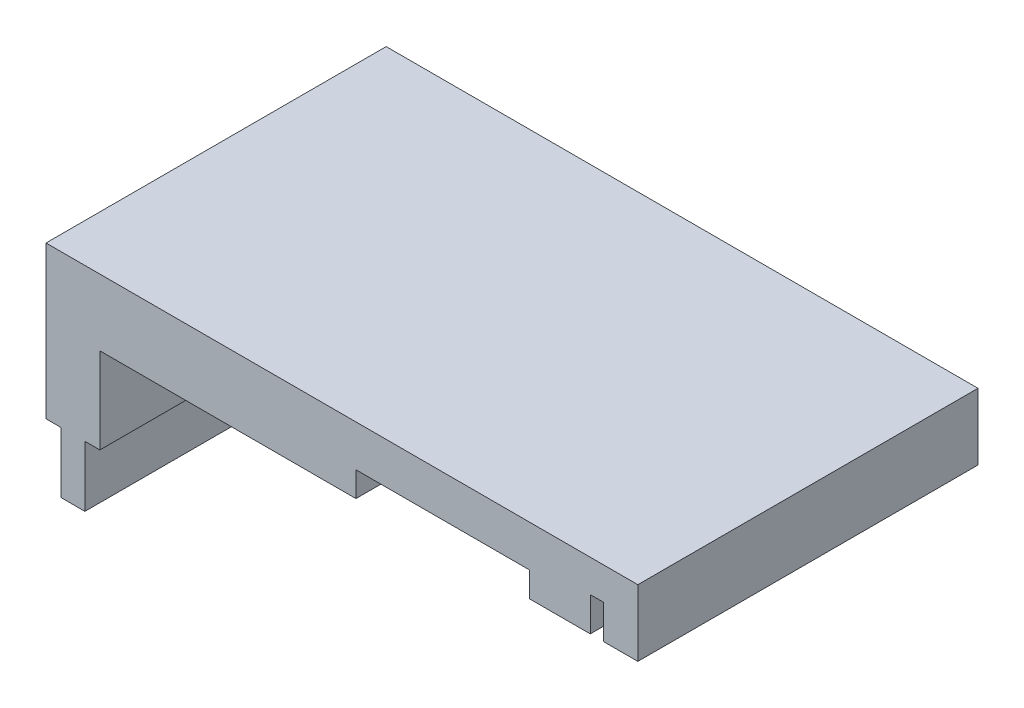
from build123d import *

# Parameters (mm, degrees)
BOSS_EXTRUDE1_DEPTH = 95.25
SKETCH3_W           = 9
SKETCH3_H           = 41.03
CUT_EXTRUDE1_DEPTH  = 183.880891019
SKETCH4_R           = 1.03
CUT_EXTRUDE2_DEPTH  = 3


with BuildPart() as part:
    # Sketch1 → Boss-Extrude1 (new body)
    with BuildSketch(Plane.XY):
        Polygon((0, 0), (0, 18.61), (-165.72, 18.61), (-165.72, -24.03), (-161.52, -24.03), (-161.52, -41.03), (-154.83, -41.03), (-154.83, -24.03), (-150.63, -24.03), (-150.63, 0.01), (-78.94, 0.01), (-78.94, 7.01), (-30.27, 7.01), (-30.27, 0.01), (-13.32, 0.01), (-13.32, 9.54), (-9.63, 9.54), (-9.63, 0), align=None)
    extrude(amount=BOSS_EXTRUDE1_DEPTH)

    # Sketch3 → Cut-Extrude1 (cut, through all)
    with BuildSketch(Plane(origin=(-150.63, 0, 0), x_dir=(0, 0, -1), z_dir=(1, 0, 0))):
        with Locations((-4.5, -20.515)):
            Rectangle(SKETCH3_W, SKETCH3_H)
    extrude(amount=-CUT_EXTRUDE1_DEPTH, mode=Mode.SUBTRACT)

    # Sketch4 → Cut-Extrude2 (cut)
    with BuildSketch(Plane.XZ.offset(-7.01)):
        with Locations(Location((-69.08, 42.44, 0), (0, 0, 270))):
            Circle(SKETCH4_R)
        with Locations(Location((-49.58, 60.2, 0), (0, 0, 270))):
            Circle(SKETCH4_R)
    extrude(amount=-CUT_EXTRUDE2_DEPTH, mode=Mode.SUBTRACT)


solid = part.part
